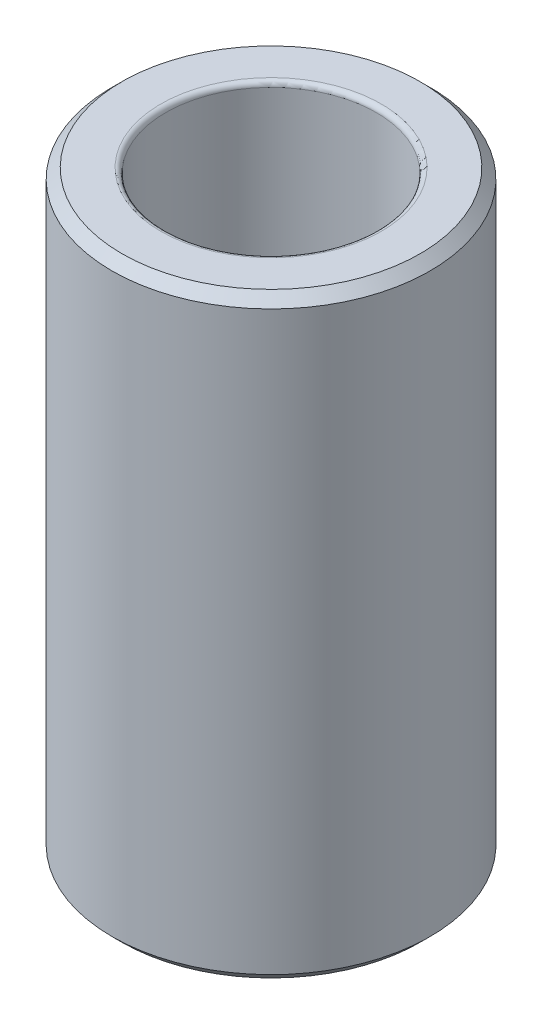
from build123d import *

# Parameters (mm, degrees)
SKETCH2_R           = 4
SKETCH2_R_2         = 2.65
BOSS_EXTRUDE1_DEPTH = 15
CHAMFER1_SIZE       = 0.25
FILLET2_R           = 0.125


with BuildPart() as part:
    # Sketch2 → Boss-Extrude1 (new body)
    with BuildSketch(Plane(origin=(0, 0, 0), x_dir=(1, 0, 0), z_dir=(0, 1, 0))):
        with Locations(Location((0, 0, 0), (0, 0, 270))):
            Circle(SKETCH2_R)
        with Locations(Location((0, 0, 0), (0, 0, 270))):
            Circle(SKETCH2_R_2, mode=Mode.SUBTRACT)
    extrude(amount=BOSS_EXTRUDE1_DEPTH)

    # Chamfer1
    chamfer1_edges = [part.edges().sort_by_distance(p)[0] for p in [
        (0, 0, -4),
        (0, 15, -4),
    ]]
    chamfer(chamfer1_edges, length=CHAMFER1_SIZE)

    # Fillet2
    fillet2_edges = [part.edges().sort_by_distance(p)[0] for p in [
        (0, 0, -2.65),
        (0, 15, -2.65),
    ]]
    fillet(fillet2_edges, radius=FILLET2_R)


solid = part.part
